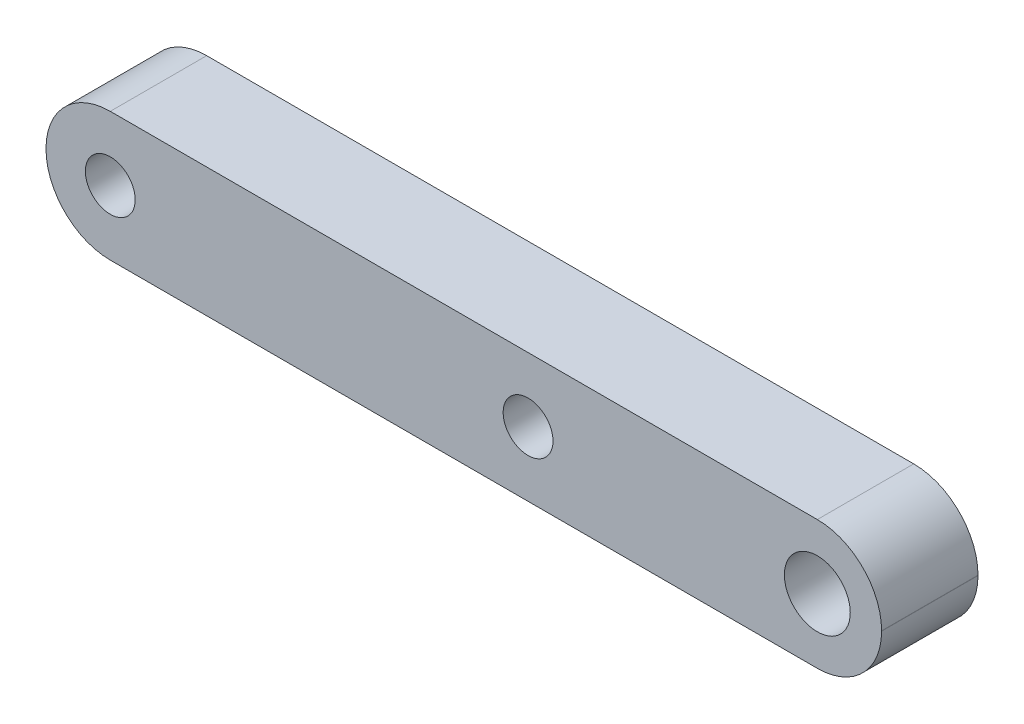
from build123d import *

# Parameters (mm, degrees)
DODANIE_WYCI_GNI_CIE1_DEPTH = 6
SZKIC2_R                    = 2.05
SZKIC2_R_2                  = 1.55
WYTNIJ_WYCI_GNI_CIE1_DEPTH  = 6


with BuildPart() as part:
    # Szkic1 → Dodanie-wyciągnięcie1 (new body)
    with BuildSketch(Plane.XY):
        with BuildLine():
            Line((148.389986738, 90.204311715), (148.389986738, 90.184311715))
            ThreePointArc((148.389986738, 90.184311715), (149.561559613, 87.35588459), (152.389986738, 86.184311715))
            Line((152.389986738, 86.184311715), (196.389986738, 86.184311715))
            ThreePointArc((196.389986738, 86.184311715), (199.218413863, 87.35588459), (200.389986738, 90.184311715))
            Line((200.389986738, 90.184311715), (200.389986738, 90.204311715))
            ThreePointArc((200.389986738, 90.204311715), (199.218413863, 93.032738839), (196.389986738, 94.204311715))
            Line((196.389986738, 94.204311715), (152.389986738, 94.204311715))
            ThreePointArc((152.389986738, 94.204311715), (149.561559613, 93.032738839), (148.389986738, 90.204311715))
        make_face()
    extrude(amount=DODANIE_WYCI_GNI_CIE1_DEPTH)

    # Szkic2 → Wytnij-wyciągnięcie1 (cut)
    with BuildSketch(Plane.XY.offset(6)):
        with Locations((196.389986738, 90.204311714)):
            Circle(SZKIC2_R)
        with Locations((178.389986738, 90.204311714)):
            Circle(SZKIC2_R_2)
        with Locations((152.389986738, 90.204311714)):
            Circle(SZKIC2_R_2)
    extrude(amount=-WYTNIJ_WYCI_GNI_CIE1_DEPTH, mode=Mode.SUBTRACT)


solid = part.part
